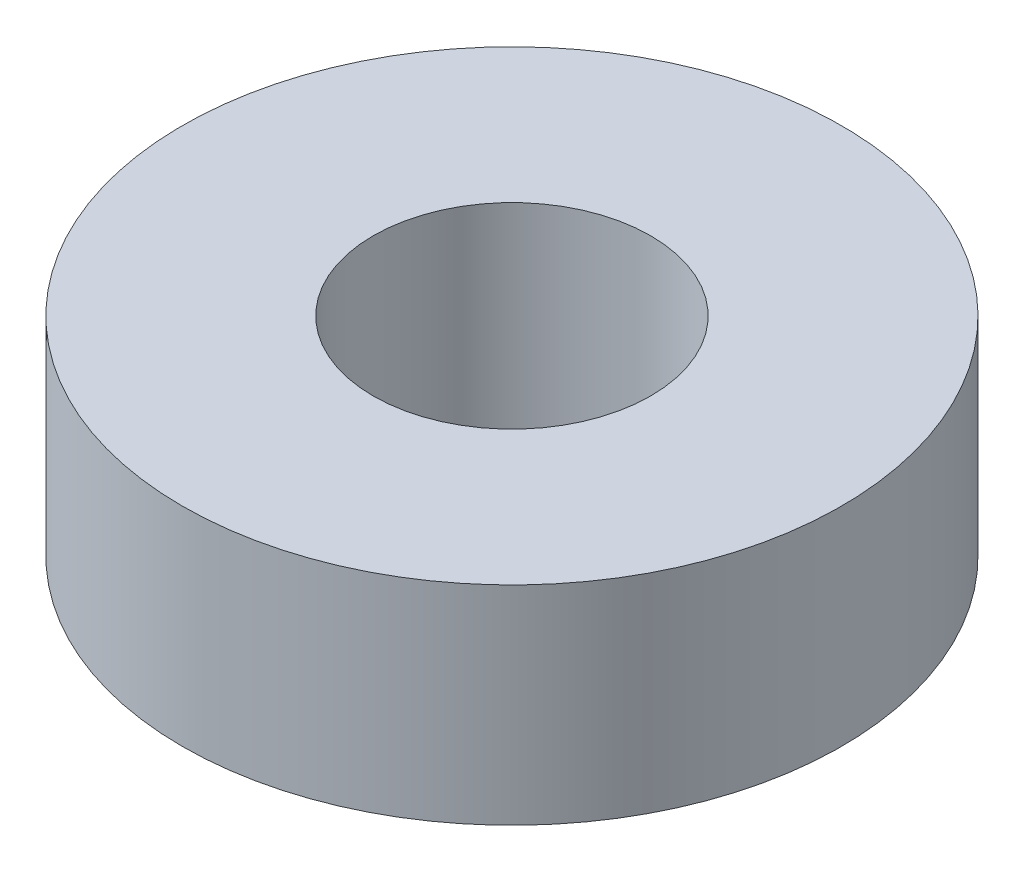
from build123d import *

# Parameters (mm, degrees)
SKETCH1_R           = 4.75
SKETCH1_R_2         = 2
BOSS_EXTRUDE1_DEPTH = 3


with BuildPart() as part:
    # Sketch1 → Boss-Extrude1 (new body)
    with BuildSketch(Plane(origin=(0, 0, 0), x_dir=(1, 0, 0), z_dir=(0, 1, 0))):
        with Locations(Location((0, 0, 0), (0, 0, 270))):
            Circle(SKETCH1_R)
        with Locations(Location((0, 0, 0), (0, 0, 270))):
            Circle(SKETCH1_R_2, mode=Mode.SUBTRACT)
    extrude(amount=BOSS_EXTRUDE1_DEPTH)


solid = part.part
